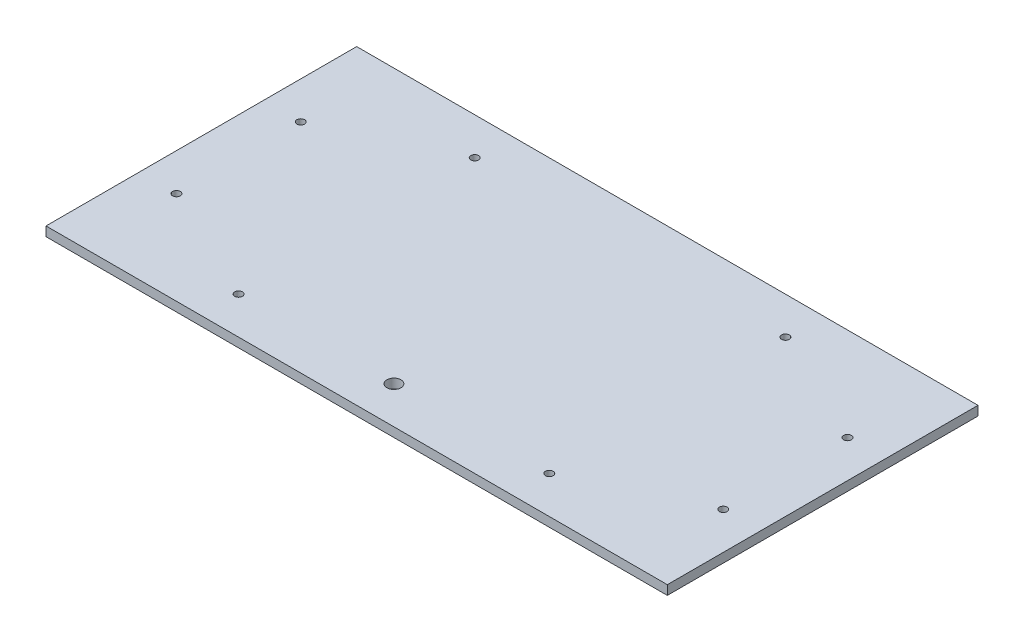
from build123d import *

# Parameters (mm, degrees)
ESQUISSE1_W             = 400
ESQUISSE1_H             = 200
BOSS_EXTRU_1_DEPTH      = 6
ESQUISSE2_R             = 2.5
ENL_V_MAT_EXTRU_1_DEPTH = 224.687281713
ESQUISSE3_R             = 4.5
ENL_V_MAT_EXTRU_2_DEPTH = 224.687281713


with BuildPart() as part:
    # Esquisse1 → Boss.-Extru.1 (new body)
    with BuildSketch(Plane(origin=(0, 0, 0), x_dir=(1, 0, 0), z_dir=(0, 1, 0))):
        Rectangle(ESQUISSE1_W, ESQUISSE1_H)
    extrude(amount=BOSS_EXTRU_1_DEPTH)

    # Esquisse2 → Enlèv. mat.-Extru.1 (cut, through all)
    with BuildSketch(Plane(origin=(0, 6, 0), x_dir=(1, 0, 0), z_dir=(0, 1, 0))):
        with Locations(Location((-100, 76, 0), (0, 0, 270))):
            Circle(ESQUISSE2_R)
        with Locations(Location((100, 76, 0), (0, 0, 270))):
            Circle(ESQUISSE2_R)
        with Locations(Location((100, -76, 0), (0, 0, 270))):
            Circle(ESQUISSE2_R)
        with Locations(Location((-100, -76, 0), (0, 0, 270))):
            Circle(ESQUISSE2_R)
        with Locations(Location((-176, 40, 0), (0, 0, 270))):
            Circle(ESQUISSE2_R)
        with Locations(Location((-176, -40, 0), (0, 0, 270))):
            Circle(ESQUISSE2_R)
        with Locations(Location((176, -40, 0), (0, 0, 270))):
            Circle(ESQUISSE2_R)
        with Locations(Location((176, 40, 0), (0, 0, 270))):
            Circle(ESQUISSE2_R)
    extrude(amount=-ENL_V_MAT_EXTRU_1_DEPTH, mode=Mode.SUBTRACT)

    # Esquisse3 → Enlèv. mat.-Extru.2 (cut, through all)
    with BuildSketch(Plane(origin=(0, 6, 0), x_dir=(1, 0, 0), z_dir=(0, 1, 0))):
        with Locations(Location((0, -76, 0), (0, 0, 270))):
            Circle(ESQUISSE3_R)
    extrude(amount=-ENL_V_MAT_EXTRU_2_DEPTH, mode=Mode.SUBTRACT)


solid = part.part
